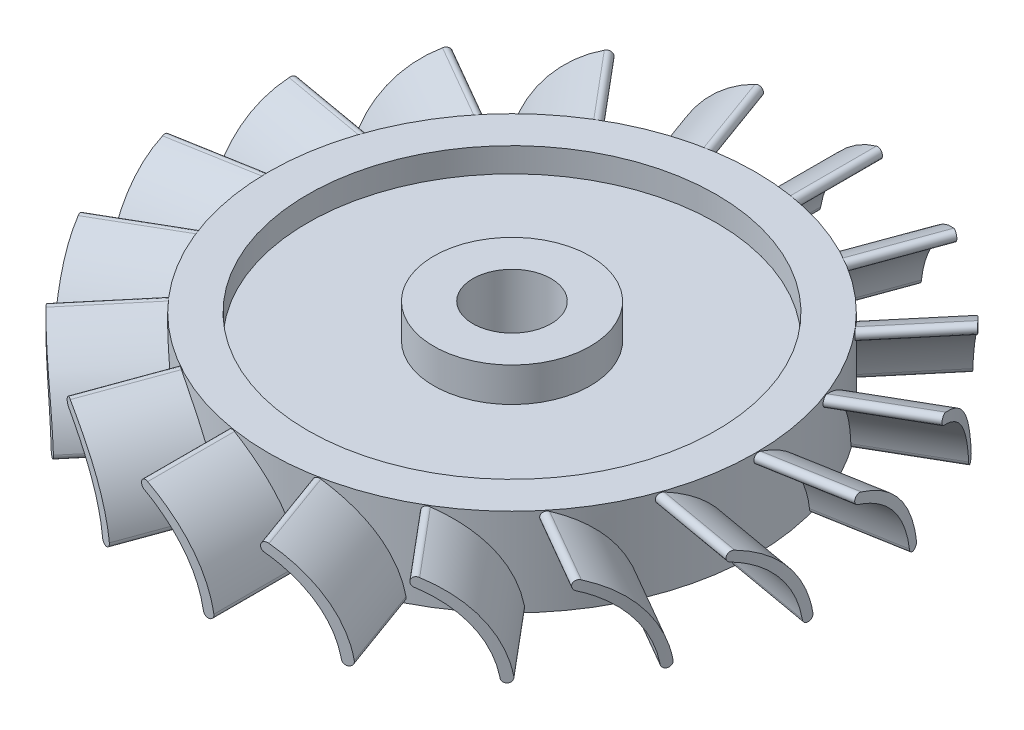
from build123d import *

# Parameters (mm, degrees)
Y_KSEKLIK_EKSTR_ZYON5_DEPTH = 10.4
DAIRESEL_KAPLAMA2_COUNT     = 18
IZIM3_W                     = 2
IZIM3_H                     = 30.333226327


with BuildPart() as part:
    # Çizim1 → Döndür1 (revolve)
    with BuildSketch(Plane.XY, mode=Mode.PRIVATE) as d_nd_r1_sk:
        Polygon((-20.9, -0.109530405), (-24.9, -0.109530405), (-24.9, -9.109530405), (-20.9, -9.109530405), (-20.9, -6.609530405), (-8, -6.609530405), (-8, -9.109530405), (-4, -9.109530405), (-4, 0.890469595), (-8, 0.890469595), (-8, -2.609530405), (-20.9, -2.609530405), align=None)
    revolve(d_nd_r1_sk.sketch.rotate(Axis((0, -2.29652027, 0), (0, 1, 0)), 270), axis=Axis((0, -2.29652027, 0), (0, 1, 0)))

    # Çizim2 → Yükseklik-Ekstrüzyon5 (add)
    with BuildSketch(Plane.XY.offset(24)):
        with BuildLine():
            ThreePointArc((3.068179394, -8.521708751), (0.789433122, -3.435464173), (-3.77125032, -0.231913795))
            ThreePointArc((-3.77125032, -0.231913795), (-4.461363918, -0.515956864), (-4.108256859, -1.173416101))
            ThreePointArc((-4.108256859, -1.173416101), (0, -4.050024003), (2.071012542, -8.617688011))
            ThreePointArc((2.071012542, -8.617688011), (2.620383371, -9.097348992), (3.068179394, -8.521708751))
        make_face()
    y_kseklik_ekstr_zyon5 = extrude(amount=Y_KSEKLIK_EKSTR_ZYON5_DEPTH)

    # Dairesel Kaplama2: Yükseklik-Ekstrüzyon5 ×18 about axis
    dairesel_kaplama2_axis = Axis((0, 0, 0), (0, 1, 0))
    for i in range(1, DAIRESEL_KAPLAMA2_COUNT):
        add(y_kseklik_ekstr_zyon5.rotate(dairesel_kaplama2_axis, i * 360 / DAIRESEL_KAPLAMA2_COUNT))

    # Çizim3 → Kes-Döndür1 (revolve, cut)
    with BuildSketch(Plane.XY):
        with Locations((34.7, 0.524712506)):
            Rectangle(IZIM3_W, IZIM3_H)
    revolve(axis=Axis((0, -14.641900658, 0), (0, 1, 0)), mode=Mode.SUBTRACT)


solid = part.part
